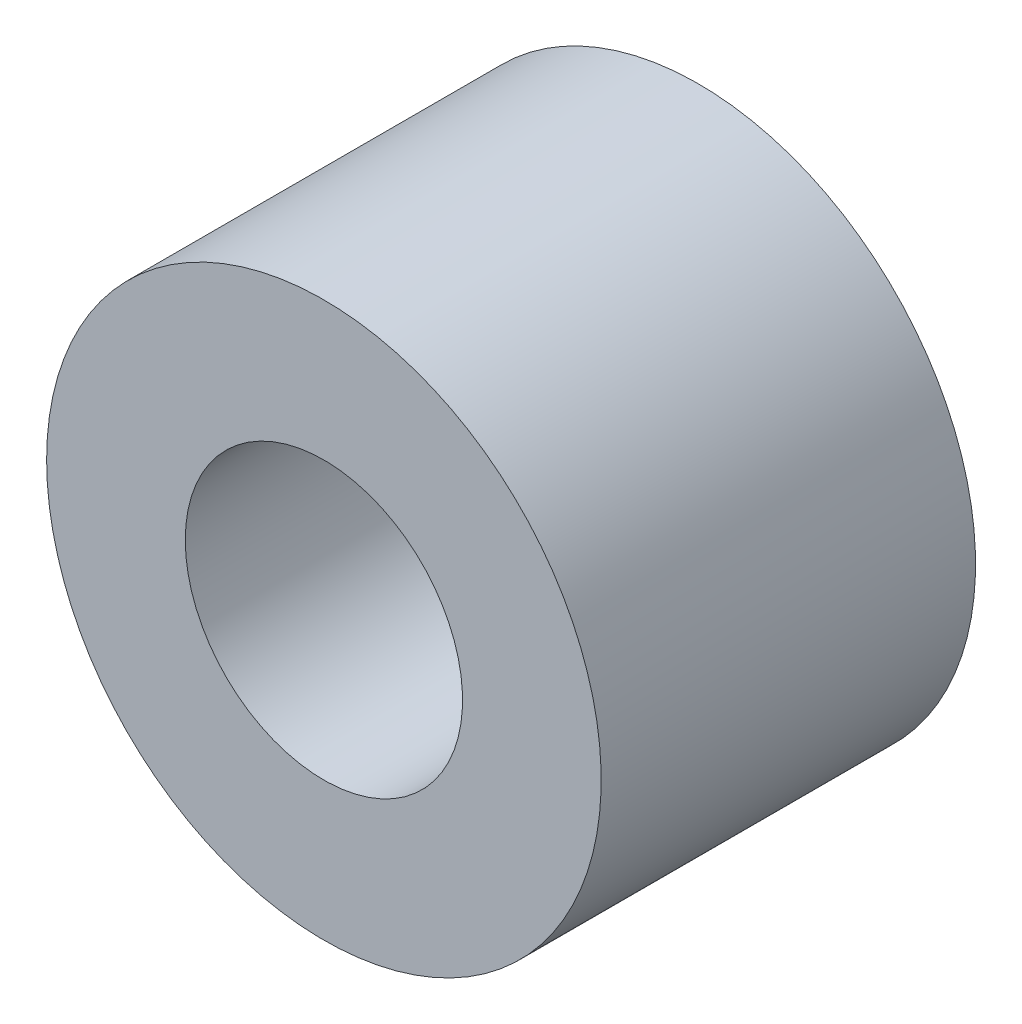
from build123d import *

# Parameters (mm, degrees)
CROQUIS1_R              = 2
CROQUIS1_R_2            = 1
SALIENTE_EXTRUIR1_DEPTH = 2.7


with BuildPart() as part:
    # Croquis1 → Saliente-Extruir1 (new body)
    with BuildSketch(Plane.XY):
        with Locations(Location((0, 0, 0), (0, 0, 180))):
            Circle(CROQUIS1_R)
        with Locations(Location((0, 0, 0), (0, 0, 180))):
            Circle(CROQUIS1_R_2, mode=Mode.SUBTRACT)
    extrude(amount=SALIENTE_EXTRUIR1_DEPTH)


solid = part.part
